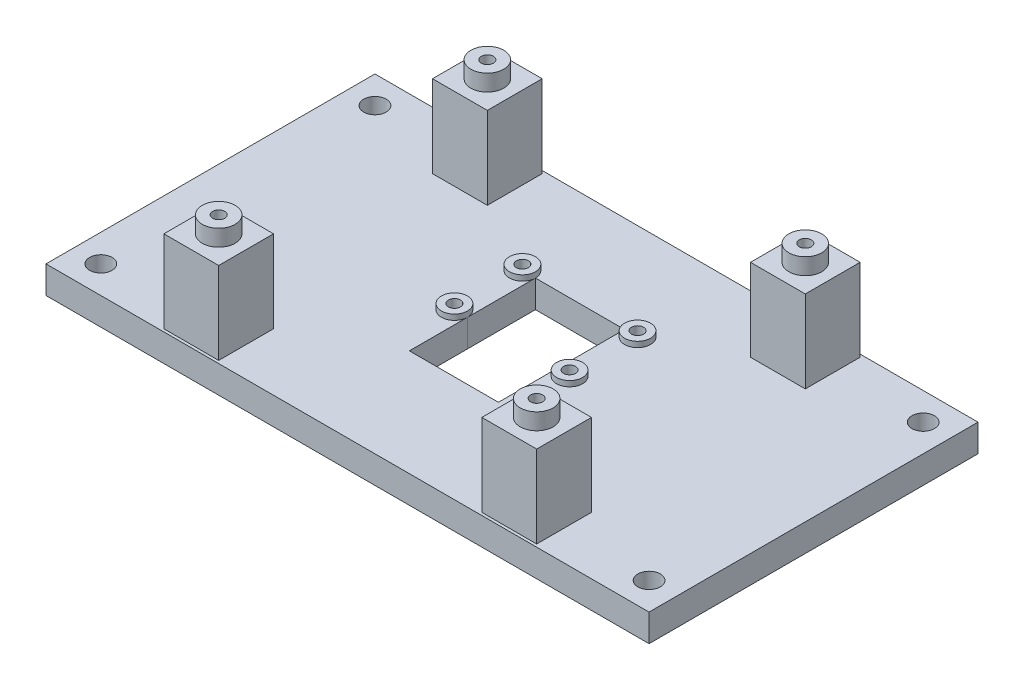
from build123d import *
from build123d.topology import SkipClean

# Parameters (mm, degrees)
ESQUISSE1_W             = 110
ESQUISSE1_H             = 60
BOSS_EXTRU_2_DEPTH      = 5
BOSS_EXTRU_3_START      = 1
ESQUISSE3_R             = 2.375
ESQUISSE3_R_2           = 1.1
BOSS_EXTRU_3_DEPTH      = 1
ESQUISSE4_W             = 5
ESQUISSE4_H             = 5
BOSS_EXTRU_5_DEPTH      = 15
ESQUISSE5_R             = 3
BOSS_EXTRU_6_DEPTH      = 3
ESQUISSE10_R            = 1.1
ENL_V_MAT_EXTRU_1_DEPTH = 10
ESQUISSE11_R            = 2.05
ENL_V_MAT_EXTRU_2_DEPTH = 10


with BuildPart() as part:
    # Esquisse1 → Boss.-Extru.2 (new body)
    # profile 1 of 22: a face of its own
    with BuildSketch(Plane(origin=(0, 0, 0), x_dir=(1, 0, 0), z_dir=(0, 1, 0))):
        Rectangle(ESQUISSE1_W, ESQUISSE1_H)
        with BuildLine():
            Line((-10.5, 2.375), (-10.5, 6.25))
            Line((-10.5, 6.25), (-10.5, 10.025))
            ThreePointArc((-10.5, 10.025), (-11.41471017, 10.208212988), (-12.188294627, 10.729585006))
            ThreePointArc((-12.188294627, 10.729585006), (-12.170414994, 14.088294627), (-8.811705373, 14.070414994))
            ThreePointArc((-8.811705373, 14.070414994), (-8.303374777, 13.303029695), (-8.125, 12.4))
            Line((-8.125, 12.4), (8.125, 12.4))
            ThreePointArc((8.125, 12.4), (8.345504143, 13.399386113), (8.966071665, 14.213198517))
            ThreePointArc((8.966071665, 14.213198517), (11.499386113, 14.554495857), (12.875, 12.4))
            ThreePointArc((12.875, 12.4), (12.654495857, 11.400613887), (12.033928335, 10.586801483))
            ThreePointArc((12.033928335, 10.586801483), (11.316785933, 10.169868672), (10.5, 10.025))
            Line((10.5, 10.025), (10.5, 2.375))
            ThreePointArc((10.5, 2.375), (11.368284246, 2.210589846), (12.116353968, 1.740122079))
            ThreePointArc((12.116353968, 1.740122079), (12.677092749, 0.949153393), (12.875, 0))
            ThreePointArc((12.875, 0), (11.449153393, -2.177092749), (8.883646032, -1.740122079))
            ThreePointArc((8.883646032, -1.740122079), (8.322907249, -0.949153387), (8.125, 1.1e-08))
            Line((8.125, 1.1e-08), (8.125, -10.6))
            Line((8.125, -10.6), (-8.125, -10.6))
            Line((-8.125, -10.6), (-8.125, 0))
            ThreePointArc((-8.125, 0), (-8.279774736, -0.843341435), (-8.723926127, -1.576764598))
            ThreePointArc((-8.723926127, -1.576764598), (-12.076764598, -1.776073873), (-12.276073873, 1.576764598))
            ThreePointArc((-12.276073873, 1.576764598), (-11.473603893, 2.166268788), (-10.5, 2.375))
        make_face(mode=Mode.SUBTRACT)
    # profile 2 of 22: a face of its own
    with BuildSketch(Plane(origin=(0, 0, 0), x_dir=(1, 0, 0), z_dir=(0, 1, 0))):
        with BuildLine():
            Line((-10.5, 6.25), (-8.125, 6.25))
            Line((-8.125, 6.25), (-8.125, 12.4))
            ThreePointArc((-8.125, 12.4), (-8.820621395, 10.720621395), (-10.5, 10.025))
            Line((-10.5, 10.025), (-10.5, 6.25))
        make_face()
    # profile 3 of 22: a face of its own
    with BuildSketch(Plane(origin=(0, 0, 0), x_dir=(1, 0, 0), z_dir=(0, 1, 0))):
        with BuildLine():
            Line((-8.125, 0), (-8.125, 6.25))
            Line((-8.125, 6.25), (-10.5, 6.25))
            Line((-10.5, 6.25), (-10.5, 2.375))
            ThreePointArc((-10.5, 2.375), (-8.820621395, 1.679378605), (-8.125, 0))
        make_face()
    # profile 4 of 22: a face of its own
    with BuildSketch(Plane(origin=(0, 0, 0), x_dir=(1, 0, 0), z_dir=(0, 1, 0))):
        with BuildLine():
            ThreePointArc((10.5, 10.025), (8.820621395, 10.720621395), (8.125, 12.4))
            Line((8.125, 12.4), (8.125, 1.1e-08))
            ThreePointArc((8.125, 1.1e-08), (8.820621399, 1.679378609), (10.5, 2.375))
            Line((10.5, 2.375), (10.5, 10.025))
        make_face()
    # profile 5 of 22: a face of its own
    with BuildSketch(Plane(origin=(0, 0, 0), x_dir=(1, 0, 0), z_dir=(0, 1, 0))):
        with BuildLine():
            Line((9.4, 12.4), (8.125, 12.4))
            ThreePointArc((8.125, 12.4), (8.820621395, 10.720621395), (10.5, 10.025))
            Line((10.5, 10.025), (10.5, 11.3))
            ThreePointArc((10.5, 11.3), (9.722182541, 11.622182541), (9.4, 12.4))
        make_face()
    # profile 6 of 22: a face of its own
    with BuildSketch(Plane(origin=(0, 0, 0), x_dir=(1, 0, 0), z_dir=(0, 1, 0))):
        with BuildLine():
            ThreePointArc((8.966071665, 14.213198517), (8.345504143, 13.399386113), (8.125, 12.4))
            Line((8.125, 12.4), (9.4, 12.4))
            ThreePointArc((9.4, 12.4), (9.502128235, 12.862873568), (9.789548982, 13.239797208))
            Line((9.789548982, 13.239797208), (8.966071665, 14.213198517))
        make_face()
    # profile 7 of 22: a face of its own
    with BuildSketch(Plane(origin=(0, 0, 0), x_dir=(1, 0, 0), z_dir=(0, 1, 0))):
        with BuildLine():
            ThreePointArc((12.875, 12.4), (11.499386113, 14.554495857), (8.966071665, 14.213198517))
            Line((8.966071665, 14.213198517), (9.789548982, 13.239797208))
            ThreePointArc((9.789548982, 13.239797208), (10.962873568, 13.397871765), (11.6, 12.4))
            ThreePointArc((11.6, 12.4), (11.497871765, 11.937126432), (11.210451018, 11.560202792))
            Line((11.210451018, 11.560202792), (12.033928335, 10.586801483))
            ThreePointArc((12.033928335, 10.586801483), (12.654495857, 11.400613887), (12.875, 12.4))
        make_face()
    # profile 8 of 22: a face of its own
    with BuildSketch(Plane(origin=(0, 0, 0), x_dir=(1, 0, 0), z_dir=(0, 1, 0))):
        with BuildLine():
            Line((10.5, 11.3), (10.5, 10.025))
            ThreePointArc((10.5, 10.025), (11.316785933, 10.169868672), (12.033928335, 10.586801483))
            Line((12.033928335, 10.586801483), (11.210451018, 11.560202792))
            ThreePointArc((11.210451018, 11.560202792), (10.878300853, 11.367097069), (10.5, 11.3))
        make_face()
    # profile 9 of 22: a face of its own
    with BuildSketch(Plane(origin=(0, 0, 0), x_dir=(1, 0, 0), z_dir=(0, 1, 0))):
        with BuildLine():
            Line((-9.718053015, 13.173665892), (-8.811705373, 14.070414994))
            ThreePointArc((-8.811705373, 14.070414994), (-12.170414994, 14.088294627), (-12.188294627, 10.729585006))
            Line((-12.188294627, 10.729585006), (-11.281946985, 11.626334108))
            ThreePointArc((-11.281946985, 11.626334108), (-11.515143458, 12.823655236), (-10.5, 13.5))
            ThreePointArc((-10.5, 13.5), (-10.076344764, 13.415143458), (-9.718053015, 13.173665892))
        make_face()
    # profile 10 of 22: a face of its own
    with BuildSketch(Plane(origin=(0, 0, 0), x_dir=(1, 0, 0), z_dir=(0, 1, 0))):
        with BuildLine():
            ThreePointArc((-12.188294627, 10.729585006), (-11.41471017, 10.208212988), (-10.5, 10.025))
            Line((-10.5, 10.025), (-10.5, 11.3))
            ThreePointArc((-10.5, 11.3), (-10.923655236, 11.384856542), (-11.281946985, 11.626334108))
            Line((-11.281946985, 11.626334108), (-12.188294627, 10.729585006))
        make_face()
    # profile 11 of 22: a face of its own
    with BuildSketch(Plane(origin=(0, 0, 0), x_dir=(1, 0, 0), z_dir=(0, 1, 0))):
        with BuildLine():
            ThreePointArc((-10.5, 10.025), (-8.820621395, 10.720621395), (-8.125, 12.4))
            Line((-8.125, 12.4), (-9.4, 12.4))
            ThreePointArc((-9.4, 12.4), (-9.722182541, 11.622182541), (-10.5, 11.3))
            Line((-10.5, 11.3), (-10.5, 10.025))
        make_face()
    # profile 12 of 22: a face of its own
    with BuildSketch(Plane(origin=(0, 0, 0), x_dir=(1, 0, 0), z_dir=(0, 1, 0))):
        with BuildLine():
            Line((-9.4, 12.4), (-8.125, 12.4))
            ThreePointArc((-8.125, 12.4), (-8.303374777, 13.303029695), (-8.811705373, 14.070414994))
            Line((-8.811705373, 14.070414994), (-9.718053015, 13.173665892))
            ThreePointArc((-9.718053015, 13.173665892), (-9.482615686, 12.818245333), (-9.4, 12.4))
        make_face()
    # profile 13 of 22: a face of its own
    with BuildSketch(Plane(origin=(0, 0, 0), x_dir=(1, 0, 0), z_dir=(0, 1, 0))):
        with BuildLine():
            ThreePointArc((-8.723926127, -1.576764598), (-8.279774736, -0.843341435), (-8.125, 0))
            ThreePointArc((-8.125, 0), (-8.820621395, 1.679378605), (-10.5, 2.375))
            Line((-10.5, 2.375), (-10.5, 1.1))
            ThreePointArc((-10.5, 1.1), (-9.722182541, 0.777817459), (-9.4, 0))
            ThreePointArc((-9.4, 0), (-9.471685141, -0.390600243), (-9.677397364, -0.730290972))
            Line((-9.677397364, -0.730290972), (-8.723926127, -1.576764598))
        make_face()
    # profile 14 of 22: a face of its own
    with BuildSketch(Plane(origin=(0, 0, 0), x_dir=(1, 0, 0), z_dir=(0, 1, 0))):
        with BuildLine():
            Line((-10.5, 1.1), (-10.5, 2.375))
            ThreePointArc((-10.5, 2.375), (-11.473603893, 2.166268788), (-12.276073873, 1.576764598))
            Line((-12.276073873, 1.576764598), (-11.322602636, 0.730290972))
            ThreePointArc((-11.322602636, 0.730290972), (-10.950932329, 1.003324491), (-10.5, 1.1))
        make_face()
    # profile 15 of 22: a face of its own
    with BuildSketch(Plane(origin=(0, 0, 0), x_dir=(1, 0, 0), z_dir=(0, 1, 0))):
        with BuildLine():
            ThreePointArc((-8.723926127, -1.576764598), (-8.279774736, -0.843341435), (-8.125, 0))
            ThreePointArc((-8.125, 0), (-8.820621395, 1.679378605), (-10.5, 2.375))
            Line((-10.5, 2.375), (-10.5, 1.1))
            ThreePointArc((-10.5, 1.1), (-9.722182541, 0.777817459), (-9.4, 0))
            ThreePointArc((-9.4, 0), (-9.471685141, -0.390600243), (-9.677397364, -0.730290972))
            Line((-9.677397364, -0.730290972), (-8.723926127, -1.576764598))
        make_face()
    # profile 16 of 22: a face of its own
    with BuildSketch(Plane(origin=(0, 0, 0), x_dir=(1, 0, 0), z_dir=(0, 1, 0))):
        with BuildLine():
            Line((-10.5, 1.1), (-10.5, 2.375))
            ThreePointArc((-10.5, 2.375), (-11.473603893, 2.166268788), (-12.276073873, 1.576764598))
            Line((-12.276073873, 1.576764598), (-11.322602636, 0.730290972))
            ThreePointArc((-11.322602636, 0.730290972), (-10.950932329, 1.003324491), (-10.5, 1.1))
        make_face()
    # profile 17 of 22: a face of its own
    with BuildSketch(Plane(origin=(0, 0, 0), x_dir=(1, 0, 0), z_dir=(0, 1, 0))):
        with BuildLine():
            ThreePointArc((-12.276073873, 1.576764598), (-12.076764598, -1.776073873), (-8.723926127, -1.576764598))
            Line((-8.723926127, -1.576764598), (-9.677397364, -0.730290972))
            ThreePointArc((-9.677397364, -0.730290972), (-10.049067671, -1.003324491), (-10.5, -1.1))
            ThreePointArc((-10.5, -1.1), (-11.503324491, -0.450932329), (-11.322602636, 0.730290972))
            Line((-11.322602636, 0.730290972), (-12.276073873, 1.576764598))
        make_face()
    # profile 18 of 22: a face of its own
    with BuildSketch(Plane(origin=(0, 0, 0), x_dir=(1, 0, 0), z_dir=(0, 1, 0))):
        with BuildLine():
            ThreePointArc((10.5, 2.375), (8.820621399, 1.679378609), (8.125, 1.1e-08))
            ThreePointArc((8.125, 1.1e-08), (8.322907249, -0.949153387), (8.883646032, -1.740122079))
            Line((8.883646032, -1.740122079), (9.751372899, -0.805951279))
            ThreePointArc((9.751372899, -0.805951279), (9.476147861, 0.402152703), (10.5, 1.1))
            Line((10.5, 1.1), (10.5, 2.375))
        make_face()
    # profile 19 of 22: a face of its own
    with BuildSketch(Plane(origin=(0, 0, 0), x_dir=(1, 0, 0), z_dir=(0, 1, 0))):
        with BuildLine():
            ThreePointArc((12.116353968, 1.740122079), (11.368284246, 2.210589846), (10.5, 2.375))
            Line((10.5, 2.375), (10.5, 1.1))
            ThreePointArc((10.5, 1.1), (10.902152703, 1.023852139), (11.248627101, 0.805951279))
            Line((11.248627101, 0.805951279), (12.116353968, 1.740122079))
        make_face()
    # profile 20 of 22: a face of its own
    with BuildSketch(Plane(origin=(0, 0, 0), x_dir=(1, 0, 0), z_dir=(0, 1, 0))):
        with BuildLine():
            ThreePointArc((10.5, 2.375), (8.820621399, 1.679378609), (8.125, 1.1e-08))
            ThreePointArc((8.125, 1.1e-08), (8.322907249, -0.949153387), (8.883646032, -1.740122079))
            Line((8.883646032, -1.740122079), (9.751372899, -0.805951279))
            ThreePointArc((9.751372899, -0.805951279), (9.476147861, 0.402152703), (10.5, 1.1))
            Line((10.5, 1.1), (10.5, 2.375))
        make_face()
    # profile 21 of 22: a face of its own
    with BuildSketch(Plane(origin=(0, 0, 0), x_dir=(1, 0, 0), z_dir=(0, 1, 0))):
        with BuildLine():
            ThreePointArc((12.116353968, 1.740122079), (11.368284246, 2.210589846), (10.5, 2.375))
            Line((10.5, 2.375), (10.5, 1.1))
            ThreePointArc((10.5, 1.1), (10.902152703, 1.023852139), (11.248627101, 0.805951279))
            Line((11.248627101, 0.805951279), (12.116353968, 1.740122079))
        make_face()
    # profile 22 of 22: a face of its own
    with BuildSketch(Plane(origin=(0, 0, 0), x_dir=(1, 0, 0), z_dir=(0, 1, 0))):
        with BuildLine():
            Line((9.751372899, -0.805951279), (8.883646032, -1.740122079))
            ThreePointArc((8.883646032, -1.740122079), (11.449153393, -2.177092749), (12.875, 0))
            ThreePointArc((12.875, 0), (12.677092749, 0.949153393), (12.116353968, 1.740122079))
            Line((12.116353968, 1.740122079), (11.248627101, 0.805951279))
            ThreePointArc((11.248627101, 0.805951279), (11.508337694, 0.439607887), (11.6, 0))
            ThreePointArc((11.6, 0), (11.277817459, -0.777817459), (10.5, -1.1))
            ThreePointArc((10.5, -1.1), (10.097847297, -1.023852139), (9.751372899, -0.805951279))
        make_face()
    extrude(amount=-BOSS_EXTRU_2_DEPTH)

    # Esquisse3 → Boss.-Extru.3 (add)
    # profile 1 of 4: a face of its own
    with SkipClean():  # the faces are left unmerged after this step: merging them gives an invalid solid
        with BuildSketch(Plane(origin=(0, 0, 0), x_dir=(1, 0, 0), z_dir=(0, 1, 0)).offset(BOSS_EXTRU_3_START)):
            with Locations((-10.5, 12.4)):
                Circle(ESQUISSE3_R)
            with Locations(Location((-10.5, 12.4, 0), (0, 0, 270))):
                Circle(ESQUISSE3_R_2, mode=Mode.SUBTRACT)
        # profile 2 of 4: a face of its own
        with BuildSketch(Plane(origin=(0, 0, 0), x_dir=(1, 0, 0), z_dir=(0, 1, 0)).offset(BOSS_EXTRU_3_START)):
            with Locations(Location((10.5, 12.4, 0), (0, 0, 180))):
                Circle(ESQUISSE3_R)
            with Locations(Location((10.5, 12.4, 0), (0, 0, 270))):
                Circle(ESQUISSE3_R_2, mode=Mode.SUBTRACT)
        # profile 3 of 4: a face of its own
        with BuildSketch(Plane(origin=(0, 0, 0), x_dir=(1, 0, 0), z_dir=(0, 1, 0)).offset(BOSS_EXTRU_3_START)):
            with Locations(Location((10.5, 0, 0), (0, 0, 180))):
                Circle(ESQUISSE3_R)
            with Locations(Location((10.5, 0, 0), (0, 0, 270))):
                Circle(ESQUISSE3_R_2, mode=Mode.SUBTRACT)
        # profile 4 of 4: a face of its own
        with BuildSketch(Plane(origin=(0, 0, 0), x_dir=(1, 0, 0), z_dir=(0, 1, 0)).offset(BOSS_EXTRU_3_START)):
            with Locations((-10.5, 0)):
                Circle(ESQUISSE3_R)
            with Locations(Location((-10.5, 0, 0), (0, 0, 270))):
                Circle(ESQUISSE3_R_2, mode=Mode.SUBTRACT)
        extrude(amount=-BOSS_EXTRU_3_DEPTH)

    # Esquisse4 → Boss.-Extru.5 (add)
    with SkipClean():  # the faces are left unmerged after this step: merging them gives an invalid solid
        with BuildSketch(Plane(origin=(0, 0, 0), x_dir=(1, 0, 0), z_dir=(0, 1, 0))):
            Polygon((-29, -24.5), (-29, -19.5), (-34, -19.5), (-34, -29.5), (-24, -29.5), (-24, -24.5), align=None)
            with Locations((-26.5, -22)):
                Rectangle(ESQUISSE4_W, ESQUISSE4_H)
            Polygon((-34, 19.5), (-29, 19.5), (-29, 24.5), (-24, 24.5), (-24, 29.5), (-34, 29.5), align=None)
            with Locations((-26.5, 22)):
                Rectangle(ESQUISSE4_W, ESQUISSE4_H)
            Polygon((29, 24.5), (29, 19.5), (34, 19.5), (34, 29.5), (24, 29.5), (24, 24.5), align=None)
            with Locations((26.5, 22)):
                Rectangle(ESQUISSE4_W, ESQUISSE4_H)
            Polygon((34, -19.5), (29, -19.5), (29, -24.5), (24, -24.5), (24, -29.5), (34, -29.5), align=None)
            with Locations((26.5, -22)):
                Rectangle(ESQUISSE4_W, ESQUISSE4_H)
        extrude(amount=BOSS_EXTRU_5_DEPTH)

    # Esquisse5 → Boss.-Extru.6 (add)
    with SkipClean():  # the faces are left unmerged after this step: merging them gives an invalid solid
        with BuildSketch(Plane(origin=(0, 15, 0), x_dir=(1, 0, 0), z_dir=(0, 1, 0))):
            with Locations(Location((-29, -24.5, 0), (0, 0, 270))):
                Circle(ESQUISSE5_R)
            with Locations(Location((-29, 24.5, 0), (0, 0, 270))):
                Circle(ESQUISSE5_R)
            with Locations(Location((29, 24.5, 0), (0, 0, 270))):
                Circle(ESQUISSE5_R)
            with Locations(Location((29, -24.5, 0), (0, 0, 270))):
                Circle(ESQUISSE5_R)
        extrude(amount=BOSS_EXTRU_6_DEPTH)

    # Esquisse10 → Enlèv. mat.-Extru.1 (cut)
    with SkipClean():  # the faces are left unmerged after this step: merging them gives an invalid solid
        with BuildSketch(Plane(origin=(0, 18, 0), x_dir=(1, 0, 0), z_dir=(0, 1, 0))):
            with Locations(Location((-29, 24.5, 0), (0, 0, 270))):
                Circle(ESQUISSE10_R)
            with Locations(Location((29, 24.5, 0), (0, 0, 270))):
                Circle(ESQUISSE10_R)
            with Locations(Location((-29, -24.5, 0), (0, 0, 270))):
                Circle(ESQUISSE10_R)
            with Locations(Location((29, -24.5, 0), (0, 0, 270))):
                Circle(ESQUISSE10_R)
        extrude(amount=-ENL_V_MAT_EXTRU_1_DEPTH, mode=Mode.SUBTRACT)

    # Esquisse11 → Enlèv. mat.-Extru.2 (cut)
    with SkipClean():  # the faces are left unmerged after this step: merging them gives an invalid solid
        with BuildSketch(Plane(origin=(0, 0, 0), x_dir=(1, 0, 0), z_dir=(0, 1, 0))):
            with Locations(Location((-50, 25, 0), (0, 0, 270))):
                Circle(ESQUISSE11_R)
            with Locations(Location((-50, -25, 0), (0, 0, 270))):
                Circle(ESQUISSE11_R)
            with Locations(Location((50, -25, 0), (0, 0, 270))):
                Circle(ESQUISSE11_R)
            with Locations(Location((50, 25, 0), (0, 0, 270))):
                Circle(ESQUISSE11_R)
        extrude(amount=-ENL_V_MAT_EXTRU_2_DEPTH, mode=Mode.SUBTRACT)


solid = part.part
